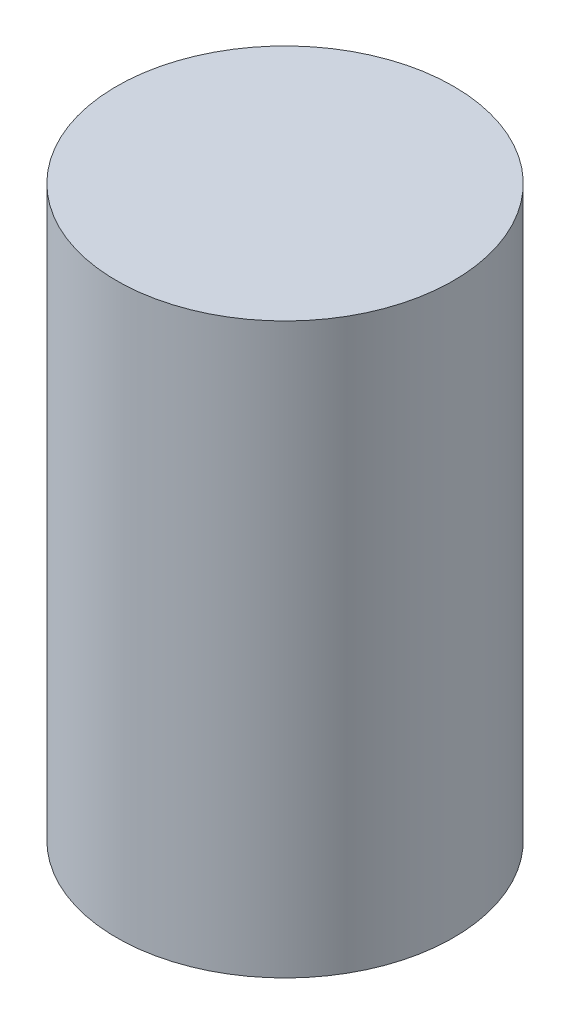
from build123d import *

# Parameters (mm, degrees)
SKETCH1_R           = 2.25
BOSS_EXTRUDE1_DEPTH = 7.6


with BuildPart() as part:
    # Sketch1 → Boss-Extrude1 (new body)
    with BuildSketch(Plane(origin=(0, 0, 0), x_dir=(1, 0, 0), z_dir=(0, 1, 0))):
        with Locations(Location((0, 0, 0), (0, 0, 90))):
            Circle(SKETCH1_R)
    extrude(amount=BOSS_EXTRUDE1_DEPTH)


solid = part.part
